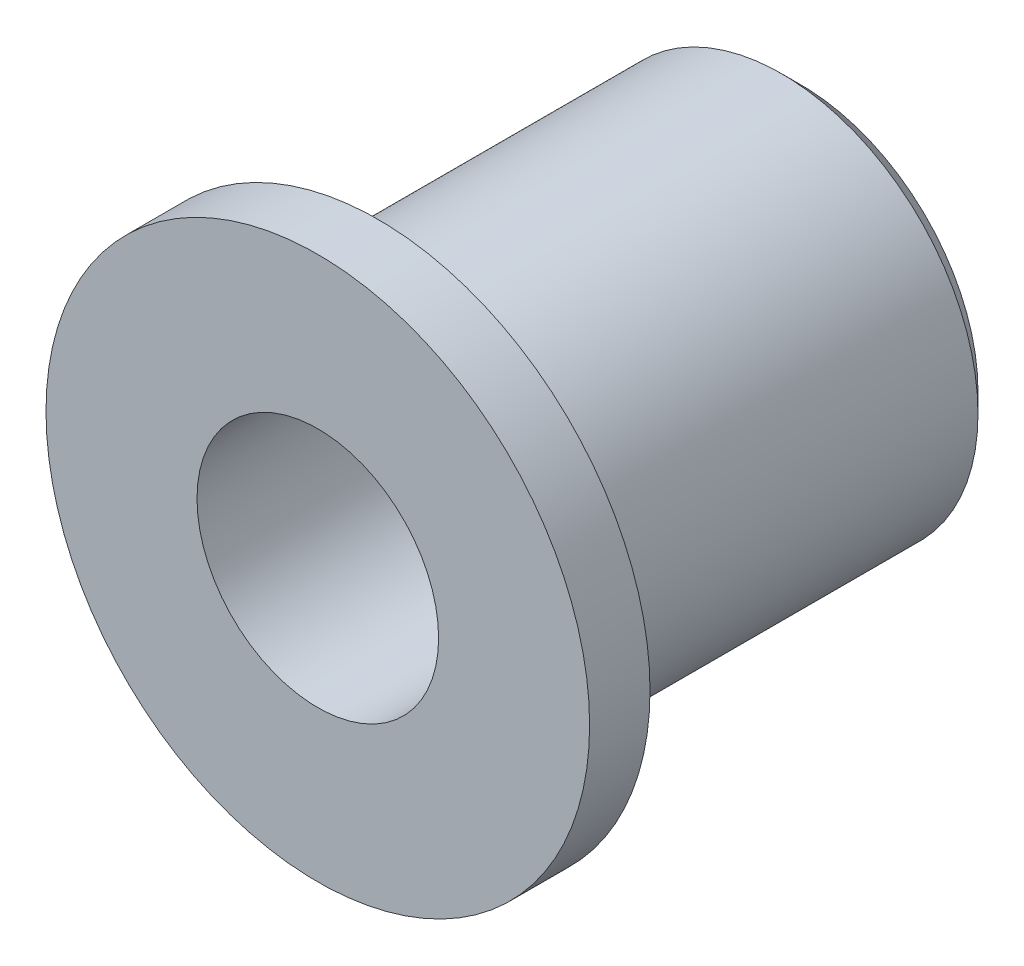
from build123d import *

# Parameters (mm, degrees)
SKETCH2_R          = 3.175
CUT_EXTRUDE1_DEPTH = 17.228257088
CHAMFER1_SIZE      = 0.508


with BuildPart() as part:
    # Sketch1 → Revolve1 (revolve)
    with BuildSketch(Plane(origin=(0, 0, 0), x_dir=(0, 0, -1), z_dir=(1, 0, 0)), mode=Mode.PRIVATE) as revolve1_sk:
        Polygon((0, 0), (0, 7.14375), (1.5875, 7.14375), (1.5875, 5.4689375), (1.4843125, 5.4689375), (1.4843125, 5.0561875), (1.8970625, 5.0561875), (1.8970625, 5.159375), (12.7, 5.159375), (12.7, 0), align=None)
    revolve(revolve1_sk.sketch.rotate(Axis((0, 0, 0), (0, 0, 1)), 90), axis=Axis((0, 0, 0), (0, 0, 1)))

    # Sketch2 → Cut-Extrude1 (cut, through all)
    with BuildSketch(Plane.XY):
        Circle(SKETCH2_R)
    extrude(amount=-CUT_EXTRUDE1_DEPTH, mode=Mode.SUBTRACT)

    # Chamfer1
    chamfer1_edges = [part.edges().sort_by_distance(p)[0] for p in [
        (5.159375, 0, -12.7),
    ]]
    chamfer(chamfer1_edges, length=CHAMFER1_SIZE)


solid = part.part
